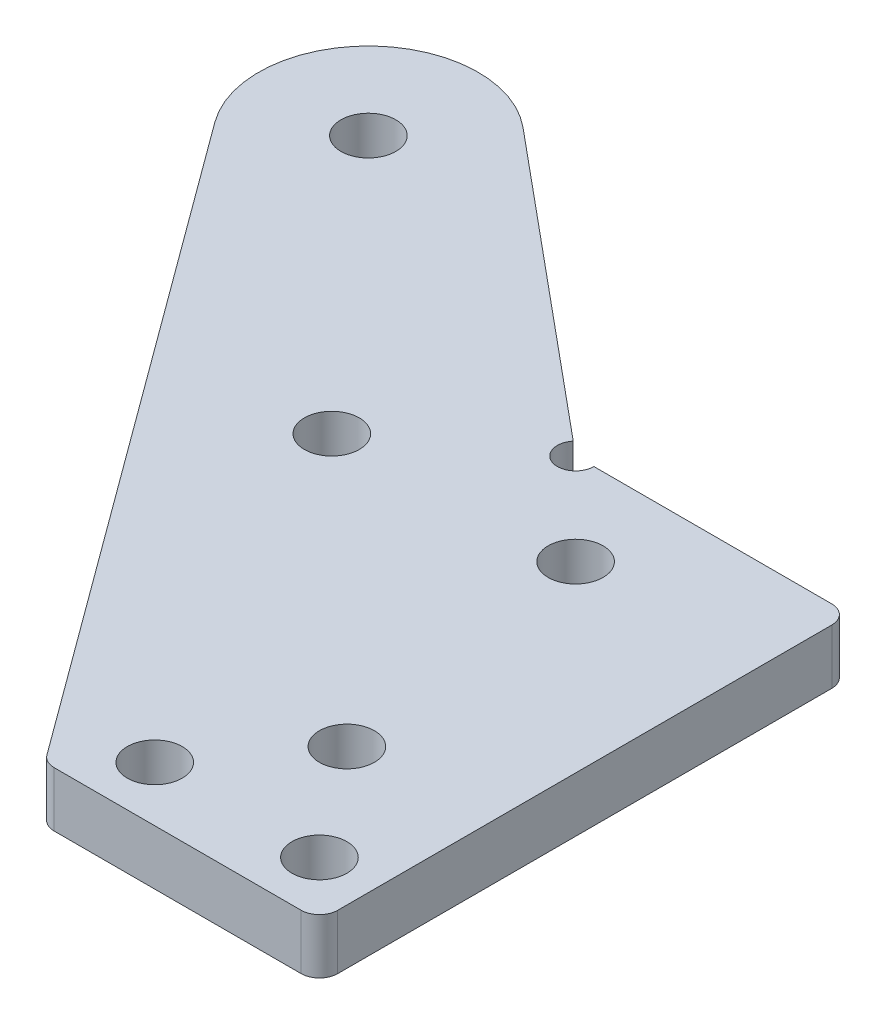
from build123d import *

# Parameters (mm, degrees)
SKETCH_1_R          = 1.5
EXTRUDE_1_DEPTH     = 3
SKETCH_3_R          = 1
CUT_EXTRUDE_2_DEPTH = 131.490420233
FILLET_1_R          = 1


with BuildPart() as part:
    # 草图1 → 凸台-拉伸1 (new body)
    with BuildSketch(Plane(origin=(0, 0, 0), x_dir=(1, 0, 0), z_dir=(0, 1, 0))):
        with BuildLine():
            Line((-107.991031726, 54.61519926), (-91, 40.5))
            Line((-91, 40.5), (-76, 40.5))
            Line((-76, 40.5), (-76, 11.5))
            Line((-76, 11.5), (-91, 11.5))
            Line((-91, 11.5), (-116.661386977, 46.448923126))
            ThreePointArc((-116.661386977, 46.448923126), (-115.938856388, 54.367705823), (-107.991031726, 54.61519926))
        make_face()
        with Locations(Location((-111.825081255, 50, 0), (0, 0, 270))):
            Circle(SKETCH_1_R, mode=Mode.SUBTRACT)
        with Locations(Location((-88, 14.5, 0), (0, 0, 270))):
            Circle(SKETCH_1_R, mode=Mode.SUBTRACT)
        with Locations(Location((-79, 14.5, 0), (0, 0, 270))):
            Circle(SKETCH_1_R, mode=Mode.SUBTRACT)
        with Locations(Location((-83.5, 20.5, 0), (0, 0, 270))):
            Circle(SKETCH_1_R, mode=Mode.SUBTRACT)
        with Locations(Location((-86, 35.5, 0), (0, 0, 270))):
            Circle(SKETCH_1_R, mode=Mode.SUBTRACT)
        with Locations(Location((-98.71745767, 34.89403416, 0), (0, 0, 270))):
            Circle(SKETCH_1_R, mode=Mode.SUBTRACT)
    extrude(amount=EXTRUDE_1_DEPTH)

    # 草图3 → 切除-拉伸2 (cut, through all)
    with BuildSketch(Plane(origin=(0, 3, 0), x_dir=(1, 0, 0), z_dir=(0, 1, 0))):
        with Locations((-91, 40.5)):
            Circle(SKETCH_3_R)
    extrude(amount=-CUT_EXTRUDE_2_DEPTH, mode=Mode.SUBTRACT)

    # 圆角1
    fillet_1_edges = [part.edges().sort_by_distance(p)[0] for p in [
        (-76, 1.5, -40.5),
        (-76, 1.5, -11.5),
        (-91, 1.5, -11.5),
    ]]
    fillet(fillet_1_edges, radius=FILLET_1_R)


solid = part.part
